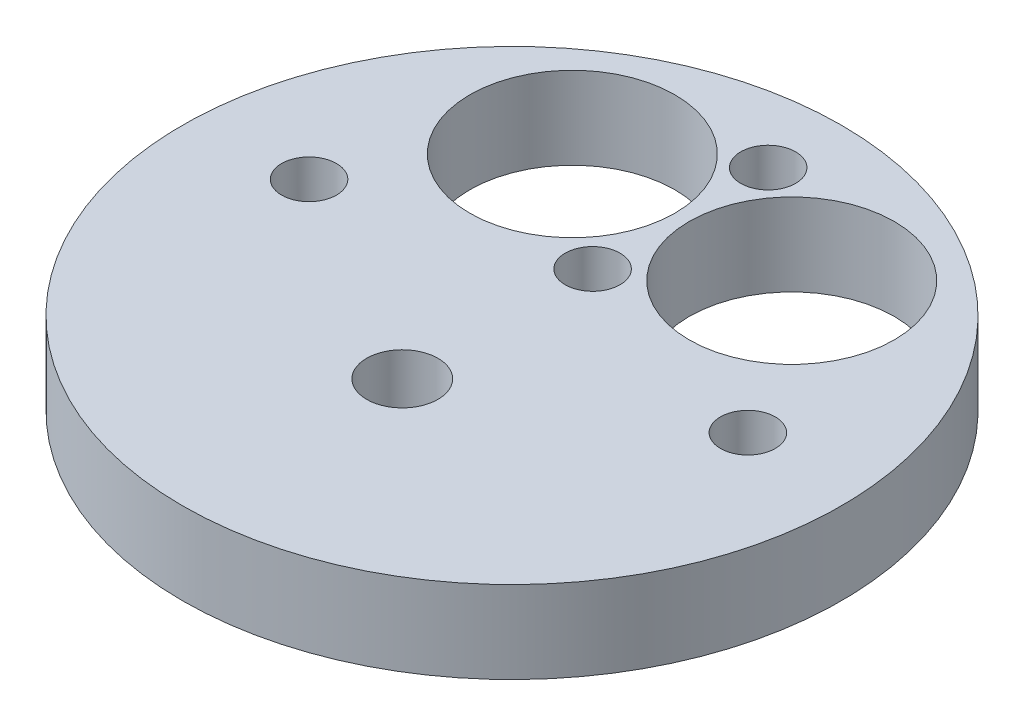
from build123d import *

# Parameters (mm, degrees)
SKETCH1_R           = 38.1508
BOSS_EXTRUDE1_DEPTH = 9.525
SKETCH19_R          = 11.8745
SKETCH19_R_2        = 3.175
CUT_EXTRUDE1_DEPTH  = 16.764
SKETCH18_R          = 3.175
CUT_EXTRUDE2_DEPTH  = 16.764
SKETCH21_R          = 4.1275
CUT_EXTRUDE3_DEPTH  = 55.787705795


with BuildPart() as part:
    # Sketch1 → Boss-Extrude1 (new body)
    with BuildSketch(Plane(origin=(0, 0, 0), x_dir=(1, 0, 0), z_dir=(0, 1, 0))):
        Circle(SKETCH1_R)
    extrude(amount=BOSS_EXTRUDE1_DEPTH)

    # Sketch19 → Cut-Extrude1 (cut)
    with BuildSketch(Plane(origin=(0, 9.525, 0), x_dir=(1, 0, 0), z_dir=(0, 1, 0))):
        with Locations((-12.7, 19.685)):
            Circle(SKETCH19_R)
        with Locations((12.7, 19.685)):
            Circle(SKETCH19_R)
        with Locations((0, 29.654011512)):
            Circle(SKETCH19_R_2)
        with Locations((0, 9.334011512)):
            Circle(SKETCH19_R_2)
    extrude(amount=-CUT_EXTRUDE1_DEPTH, mode=Mode.SUBTRACT)

    # Sketch18 → Cut-Extrude2 (cut)
    with BuildSketch(Plane(origin=(0, 9.525, 0), x_dir=(1, 0, 0), z_dir=(0, 1, 0))):
        with Locations((25.4, 1.905)):
            Circle(SKETCH18_R)
        with Locations((-25.4, 1.905)):
            Circle(SKETCH18_R)
    extrude(amount=-CUT_EXTRUDE2_DEPTH, mode=Mode.SUBTRACT)

    # Sketch21 → Cut-Extrude3 (cut, through all)
    with BuildSketch(Plane(origin=(0, 9.525, 0), x_dir=(1, 0, 0), z_dir=(0, 1, 0))):
        with Locations((0, -12.7)):
            Circle(SKETCH21_R)
    extrude(amount=-CUT_EXTRUDE3_DEPTH, mode=Mode.SUBTRACT)


solid = part.part
